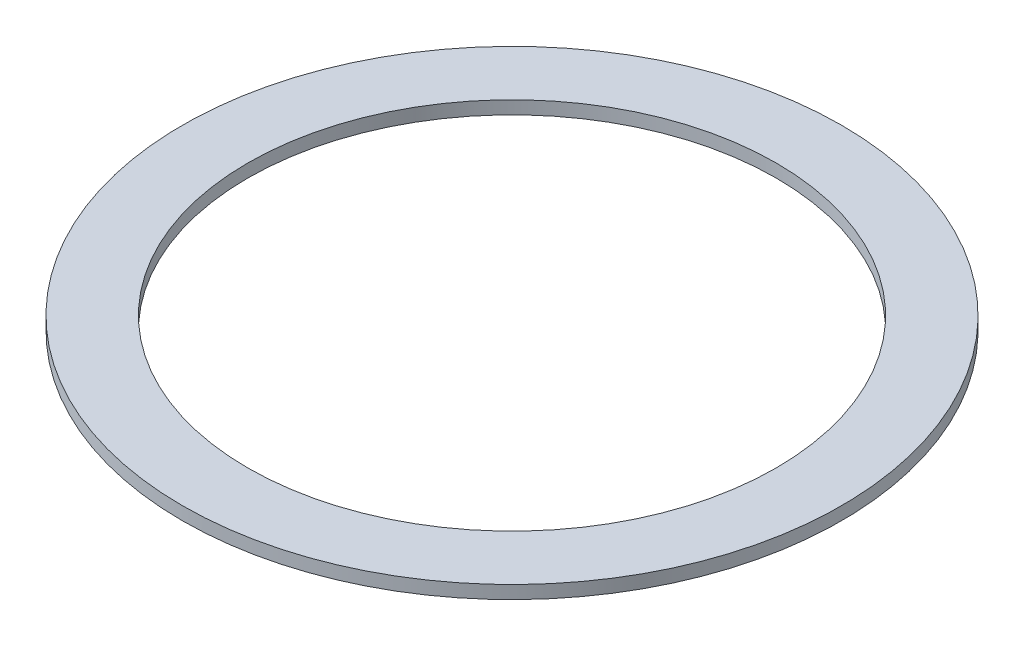
from build123d import *

# Parameters (mm, degrees)
SKETCH_1_R      = 50.4
SKETCH_1_R_2    = 40.4
EXTRUDE_1_DEPTH = 2


with BuildPart() as part:
    # 草图1 → 凸台-拉伸1 (new body)
    with BuildSketch(Plane(origin=(0, 0, 0), x_dir=(1, 0, 0), z_dir=(0, 1, 0))):
        with Locations(Location((0, 0, 0), (0, 0, 270))):
            Circle(SKETCH_1_R)
        with Locations(Location((0, 0, 0), (0, 0, 270))):
            Circle(SKETCH_1_R_2, mode=Mode.SUBTRACT)
    extrude(amount=EXTRUDE_1_DEPTH)


solid = part.part
